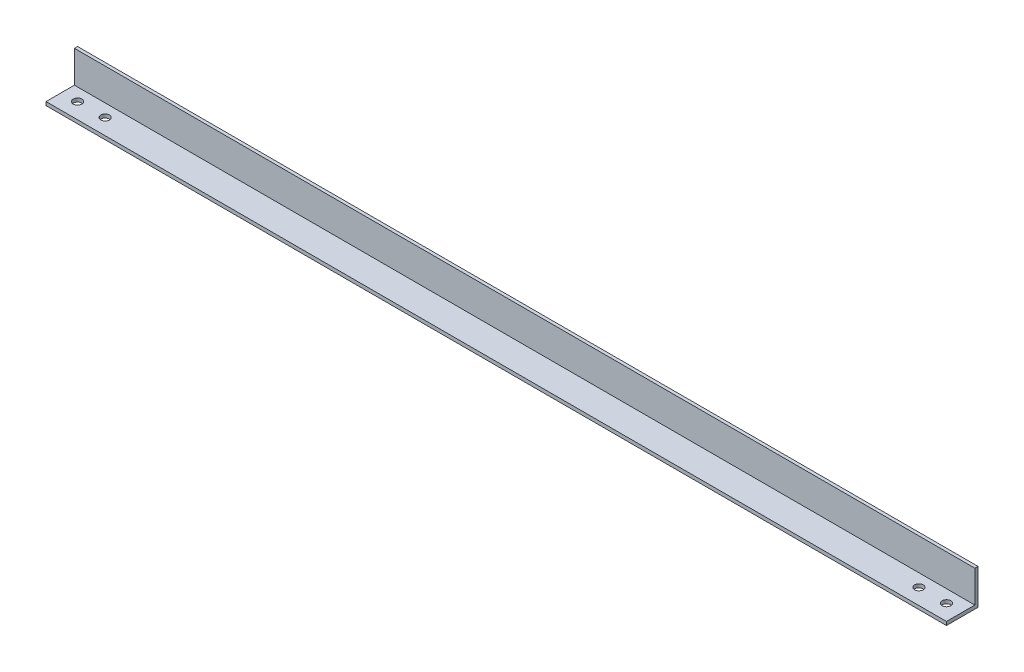
from build123d import *

# Parameters (mm, degrees)
SKETCH_263_W        = 2284
SKETCH_263_H        = 90
EXTRUDE_4_DEPTH     = 8
SKETCH_3_W          = 2284
SKETCH_3_H          = 9
EXTRUDE_5_DEPTH     = 72
SKETCH_4_R          = 11
CUT_EXTRUDE_2_DEPTH = 2287.835586569


with BuildPart() as part:
    # Sketch 263 → 拉伸4 (new body)
    with BuildSketch(Plane.XY):
        with Locations((1142, 45)):
            Rectangle(SKETCH_263_W, SKETCH_263_H)
    extrude(amount=EXTRUDE_4_DEPTH)

    # 草图3 → 拉伸5 (add)
    with BuildSketch(Plane.XY.offset(8)):
        with Locations((1142, 4.5)):
            Rectangle(SKETCH_3_W, SKETCH_3_H)
    extrude(amount=EXTRUDE_5_DEPTH)

    # 草图4 → 切除-拉伸2 (cut, through all)
    with BuildSketch(Plane(origin=(0, 9, 0), x_dir=(1, 0, 0), z_dir=(0, 1, 0))):
        with Locations(Location((39.95, -40, 0), (0, 0, 270))):
            Circle(SKETCH_4_R)
        with Locations(Location((109.95, -40, 0), (0, 0, 270))):
            Circle(SKETCH_4_R)
        with Locations(Location((2174.05, -40, 0), (0, 0, 270))):
            Circle(SKETCH_4_R)
        with Locations(Location((2244.05, -40, 0), (0, 0, 270))):
            Circle(SKETCH_4_R)
    extrude(amount=-CUT_EXTRUDE_2_DEPTH, mode=Mode.SUBTRACT)


solid = part.part
